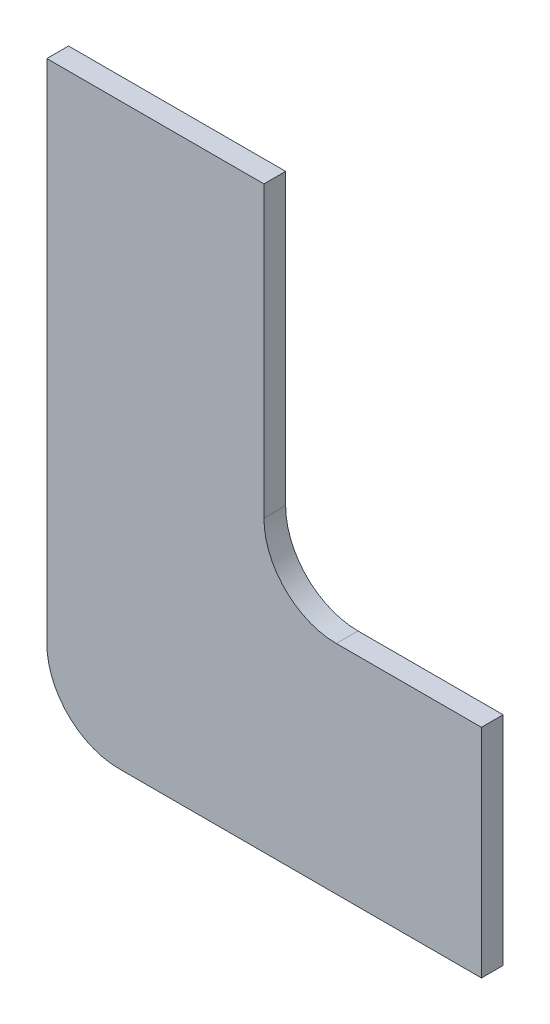
from build123d import *

# Parameters (mm, degrees)
BOSS_EXTRUDE2_DEPTH = 0.015


with BuildPart() as part:
    # Sketch3 → Boss-Extrude2 (new, symmetric)
    with BuildSketch(Plane.XY):
        with BuildLine():
            Line((0.15, 0.4), (0.15, 0))
            ThreePointArc((0.15, 0), (0.179289322, -0.070710678), (0.25, -0.1))
            Line((0.25, -0.1), (0.450569691, -0.1))
            Line((0.450569691, -0.1), (0.450569691, -0.4))
            Line((0.450569691, -0.4), (0.15, -0.4))
            Line((0.15, -0.4), (-0.05, -0.4))
            ThreePointArc((-0.05, -0.4), (-0.120710678, -0.370710678), (-0.15, -0.3))
            Line((-0.15, -0.3), (-0.15, 0.4))
            Line((-0.15, 0.4), (0.15, 0.4))
        make_face()
    extrude(amount=BOSS_EXTRUDE2_DEPTH, both=True)


solid = part.part
